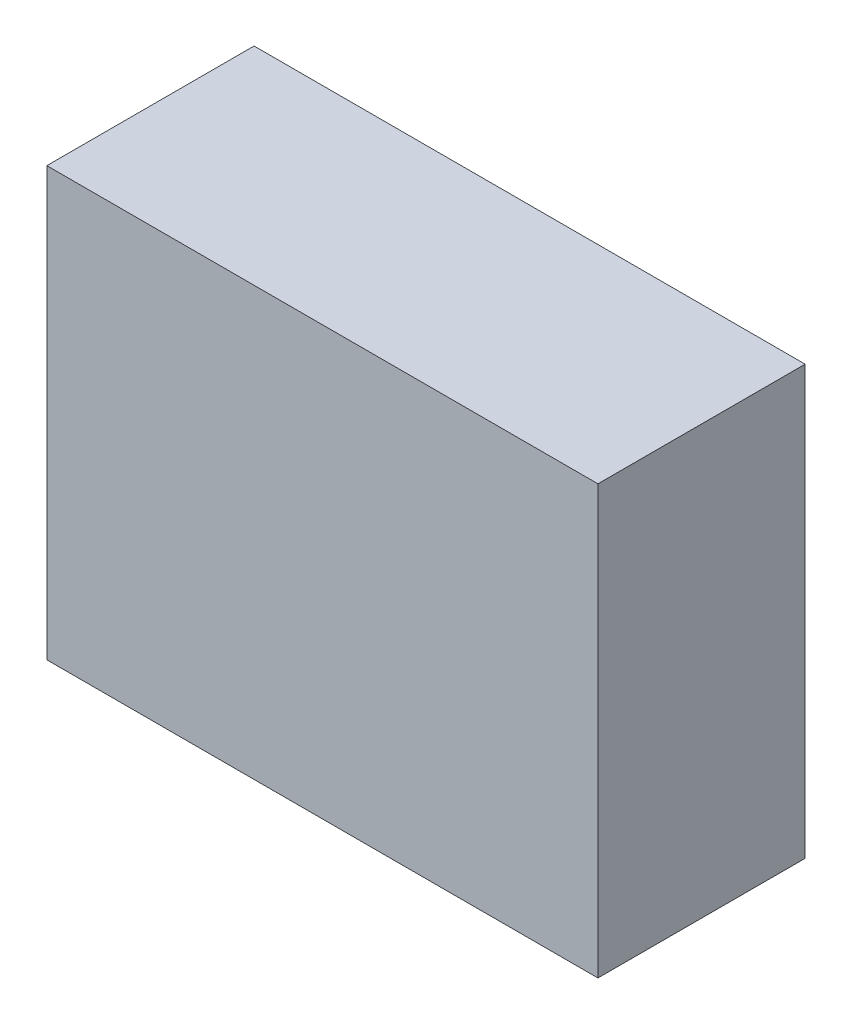
from build123d import *

# Parameters (mm, degrees)
SKETCH1_W           = 39.889462126
SKETCH1_H           = 30.979133334
BOSS_EXTRUDE1_DEPTH = 15


with BuildPart() as part:
    # Sketch1 → Boss-Extrude1 (new body)
    with BuildSketch(Plane.XY):
        with Locations((91.297472978, -35.8401771)):
            Rectangle(SKETCH1_W, SKETCH1_H)
    extrude(amount=BOSS_EXTRUDE1_DEPTH)


solid = part.part
